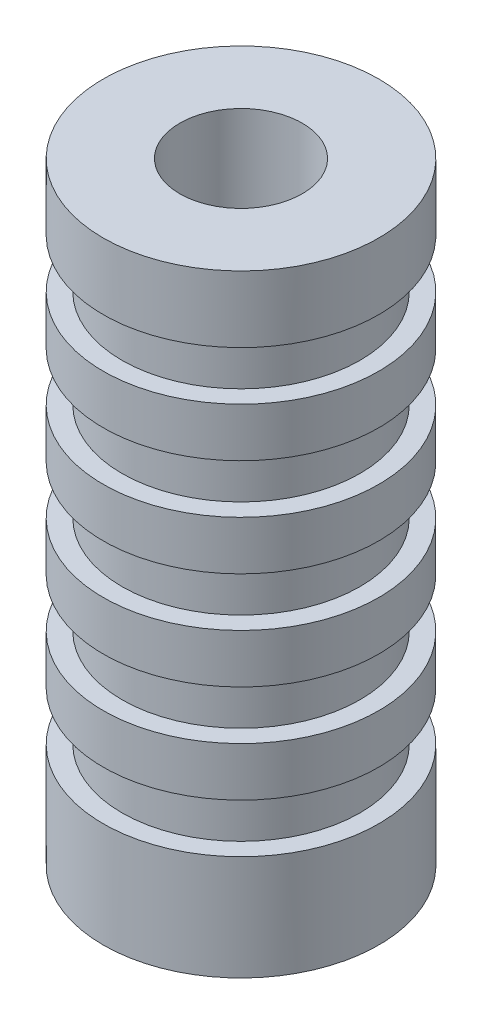
from build123d import *

# Parameters (mm, degrees)
SKETCH1_R           = 5.715
SKETCH1_R_2         = 2.54
BOSS_EXTRUDE1_DEPTH = 25.4
SKETCH3_W           = 0.779816736
SKETCH3_H           = 2.032


with BuildPart() as part:
    # Sketch1 → Boss-Extrude1 (new body)
    with BuildSketch(Plane(origin=(0, 0, 0), x_dir=(1, 0, 0), z_dir=(0, 1, 0))):
        with Locations(Location((0, 0, 0), (0, 0, 270))):
            Circle(SKETCH1_R)
        with Locations(Location((0, 0, 0), (0, 0, 270))):
            Circle(SKETCH1_R_2, mode=Mode.SUBTRACT)
    extrude(amount=BOSS_EXTRUDE1_DEPTH)

    # Sketch3 → Cut-Revolve2 (revolve, cut)
    with BuildSketch(Plane(origin=(0, 0, 0), x_dir=(0, 0, -1), z_dir=(1, 0, 0))):
        with Locations((5.325091632, 5.373385887)):
            Rectangle(SKETCH3_W, SKETCH3_H)
        with Locations((5.325091632, 9.437385887)):
            Rectangle(SKETCH3_W, SKETCH3_H)
        with Locations((5.325091632, 13.501385887)):
            Rectangle(SKETCH3_W, SKETCH3_H)
        with Locations((5.325091632, 17.565385887)):
            Rectangle(SKETCH3_W, SKETCH3_H)
        with Locations((5.325091632, 21.629385887)):
            Rectangle(SKETCH3_W, SKETCH3_H)
    revolve(axis=Axis((0, 0, 0), (0, 1, 0)), mode=Mode.SUBTRACT)


solid = part.part
